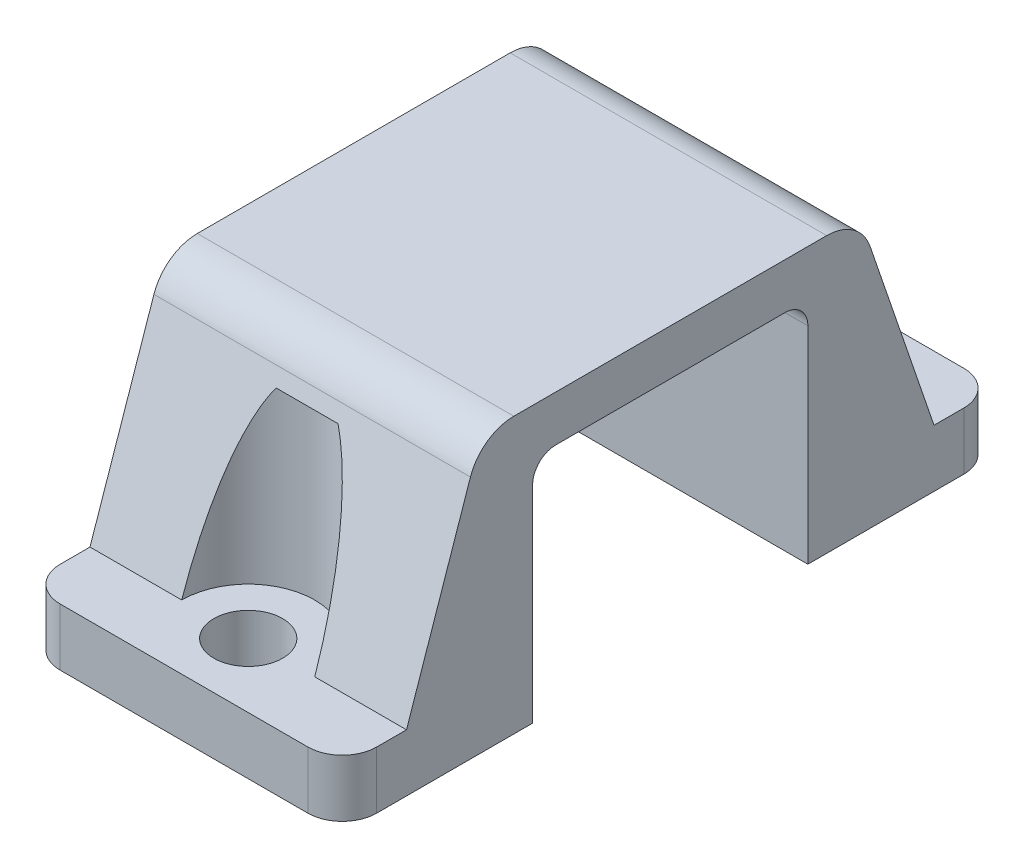
from build123d import *

# Parameters (mm, degrees)
SALIENTE_EXTRUIR1_DEPTH = 13.8
CROQUIS3_R              = 1.5
CORTAR_EXTRUIR1_DEPTH   = 10
CROQUIS3_3_R            = 2.9
CROQUIS3_3_R_2          = 1.5
CORTAR_EXTRUIR2_DEPTH   = 7.5
REDONDEO1_R             = 1
REDONDEO2_R             = 2
REDONDEO3_R             = 1.5


with BuildPart() as part:
    # Croquis1 → Saliente-Extruir1 (new body)
    with BuildSketch(Plane(origin=(0, 0, 0), x_dir=(0, 0, -1), z_dir=(1, 0, 0))):
        Polygon((-6, 0), (6, 0), (6, -10), (14.3, -10), (14.3, -7.5), (11.5, -7.5), (8.25, 2), (-8.25, 2), (-11.5, -7.5), (-14.3, -7.5), (-14.3, -10), (-6, -10), align=None)
    extrude(amount=SALIENTE_EXTRUIR1_DEPTH)

    # Croquis3 → Cortar-Extruir1 (cut)
    with BuildSketch(Plane(origin=(0, 0, 0), x_dir=(1, 0, 0), z_dir=(0, 1, 0))):
        with Locations(Location((6.9, -11.5, 0), (0, 0, 270))):
            Circle(CROQUIS3_R)
        with Locations(Location((6.9, 11.5, 0), (0, 0, 270))):
            Circle(CROQUIS3_R)
    extrude(amount=-CORTAR_EXTRUIR1_DEPTH, mode=Mode.SUBTRACT)

    # Croquis3<3> → Cortar-Extruir2 (cut)
    # profile 1 of 2: a face of its own
    with BuildSketch(Plane(origin=(0, 0, 0), x_dir=(1, 0, 0), z_dir=(0, 1, 0))):
        with Locations((6.9, -11.5)):
            Circle(CROQUIS3_3_R)
        with Locations(Location((6.9, -11.5, 0), (0, 0, 270))):
            Circle(CROQUIS3_3_R_2, mode=Mode.SUBTRACT)
    # profile 2 of 2: a face of its own
    with BuildSketch(Plane(origin=(0, 0, 0), x_dir=(1, 0, 0), z_dir=(0, 1, 0))):
        with Locations((6.9, 11.5)):
            Circle(CROQUIS3_3_R)
        with Locations(Location((6.9, 11.5, 0), (0, 0, 270))):
            Circle(CROQUIS3_3_R_2, mode=Mode.SUBTRACT)
    extrude(amount=-CORTAR_EXTRUIR2_DEPTH, mode=Mode.SUBTRACT)

    # Redondeo1
    redondeo1_edges = [part.edges().sort_by_distance(p)[0] for p in [
        (6.9, 0, -6),
        (6.9, 0, 6),
    ]]
    fillet(redondeo1_edges, radius=REDONDEO1_R)

    # Redondeo2
    redondeo2_edges = [part.edges().sort_by_distance(p)[0] for p in [
        (6.9, 2, 8.25),
        (6.9, 2, -8.25),
    ]]
    fillet(redondeo2_edges, radius=REDONDEO2_R)

    # Redondeo3
    redondeo3_edges = [part.edges().sort_by_distance(p)[0] for p in [
        (13.8, -8.75, -14.3),
        (0, -8.75, 14.3),
        (0, -8.75, -14.3),
        (13.8, -8.75, 14.3),
    ]]
    fillet(redondeo3_edges, radius=REDONDEO3_R)


solid = part.part
